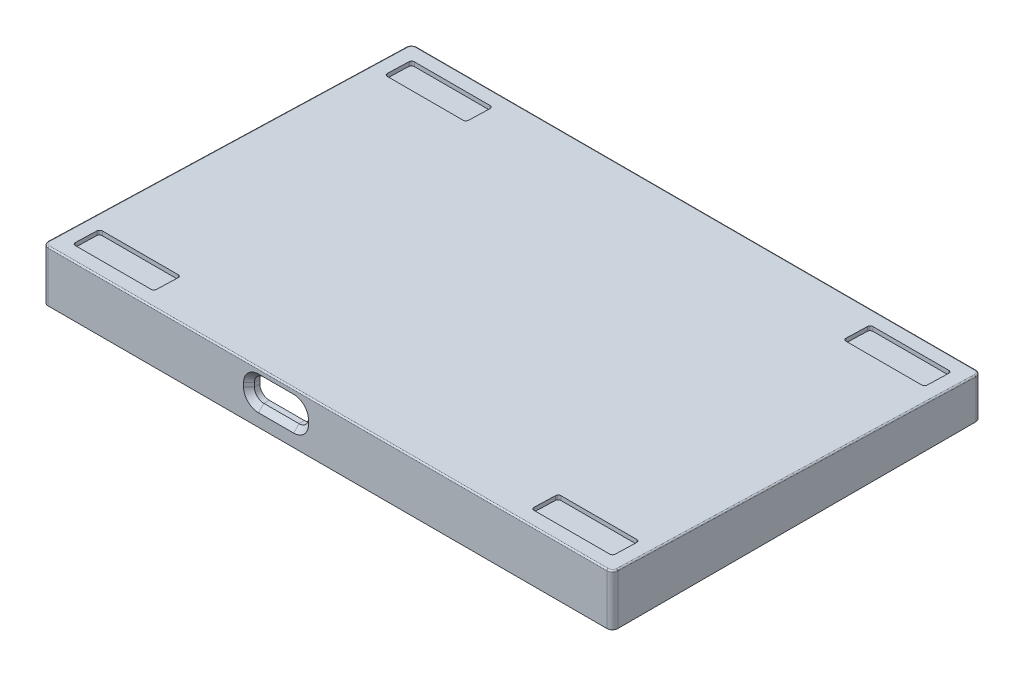
from build123d import *

# Parameters (mm, degrees)
SKETCH1_W           = 105.25
SKETCH1_H           = 68.15
SKETCH1_W_2         = 101.25
SKETCH1_H_2         = 64.15
BOSS_EXTRUDE1_DEPTH = 7.5
CUT_EXTRUDE1_DEPTH  = 125.009414965
BOSS_EXTRUDE5_DEPTH = 105.25
CUT_EXTRUDE2_REACH  = 125.247
CUT_EXTRUDE7_DEPTH  = 2
CHAMFER1_SIZE       = 1
SKETCH13_RX         = 5
SKETCH13_RY         = 4.997667954
BOSS_EXTRUDE7_DEPTH = 10
SKETCH14_W          = 64.15
SKETCH14_H          = 10
CUT_EXTRUDE3_DEPTH  = 45
SKETCH15_R          = 1.5
CUT_EXTRUDE4_DEPTH  = 3
SKETCH15_5_R        = 1.5
CUT_EXTRUDE5_DEPTH  = 4.5
FILLET1_R           = 1
FILLET2_R           = 0.25
CUT_EXTRUDE6_DEPTH  = 0.75


with BuildPart() as part:
    # Sketch1 → Boss-Extrude1 (new body)
    with BuildSketch(Plane(origin=(0, 0, 0), x_dir=(1, 0, 0), z_dir=(0, 1, 0))):
        with Locations((49.625, 31.075)):
            Rectangle(SKETCH1_W, SKETCH1_H)
        with Locations((49.625, 31.075)):
            Rectangle(SKETCH1_W_2, SKETCH1_H_2, mode=Mode.SUBTRACT)
    extrude(amount=BOSS_EXTRUDE1_DEPTH)

    # Sketch4 → Cut-Extrude1 (cut, through all)
    with BuildSketch(Plane.ZY.offset(3)):
        Polygon((-65.15, 7.5), (3, 7.5), (-65.15, 5.417829181), align=None)
    extrude(amount=-CUT_EXTRUDE1_DEPTH, mode=Mode.SUBTRACT)

    # Sketch7 → Boss-Extrude5 (add)
    with BuildSketch(Plane.ZY.offset(3)):
        Polygon((3, 7.5), (3, 9.5), (-65.15, 7.417829181), (-65.15, 5.417829181), align=None)
    extrude(amount=-BOSS_EXTRUDE5_DEPTH)

    # Sketch9 → Cut-Extrude2 (cut, up to next)
    with BuildSketch(Plane.XY.offset(3), mode=Mode.PRIVATE) as cut_extrude2_sk1:
        with BuildLine():
            Line((36.85, 7.04), (43.35, 7.04))
            ThreePointArc((43.35, 7.04), (44.233883476, 6.673883476), (44.6, 5.79))
            Line((44.6, 5.79), (44.6, 5.09))
            ThreePointArc((44.6, 5.09), (44.233883476, 4.206116524), (43.35, 3.84))
            Line((43.35, 3.84), (36.85, 3.84))
            ThreePointArc((36.85, 3.84), (35.966116524, 4.206116524), (35.6, 5.09))
            Line((35.6, 5.09), (35.6, 5.79))
            ThreePointArc((35.6, 5.79), (35.966116524, 6.673883476), (36.85, 7.04))
        make_face()
    cut_extrude2_tool1 = extrude(cut_extrude2_sk1.sketch, amount=-CUT_EXTRUDE2_REACH, mode=Mode.PRIVATE) & part.part
    add(cut_extrude2_tool1.solids().sort_by_distance((40.1, 5.44, 3))[0], mode=Mode.SUBTRACT)

    # Sketch17 → Cut-Extrude7 (cut)
    with BuildSketch(Plane.XY.offset(3)):
        with BuildLine():
            Line((35.1, 5.79), (35.1, 5.09))
            ThreePointArc((35.1, 5.09), (35.612563133, 3.852563133), (36.85, 3.34))
            Line((36.85, 3.34), (43.35, 3.34))
            ThreePointArc((43.35, 3.34), (44.587436867, 3.852563133), (45.1, 5.09))
            Line((45.1, 5.09), (45.1, 5.79))
            ThreePointArc((45.1, 5.79), (44.587436867, 7.027436867), (43.35, 7.54))
            Line((43.35, 7.54), (36.85, 7.54))
            ThreePointArc((36.85, 7.54), (35.612563133, 7.027436867), (35.1, 5.79))
        make_face()
    extrude(amount=-CUT_EXTRUDE7_DEPTH, mode=Mode.SUBTRACT)

    # Chamfer1
    chamfer1_edges = [part.edges().sort_by_distance(p)[0] for p in [
        (35.612563133, 7.027436867, 3),
        (35.1, 5.44, 3),
        (35.612563133, 3.852563133, 3),
        (40.1, 3.34, 3),
        (44.587436867, 3.852563133, 3),
        (45.1, 5.44, 3),
        (44.587436867, 7.027436867, 3),
        (40.1, 7.54, 3),
    ]]
    chamfer(chamfer1_edges, length=CHAMFER1_SIZE)

    # Sketch13 → Boss-Extrude7 (add)
    with BuildSketch(Plane(origin=(0, 7.401432685, -0.226134221), x_dir=(1, 0, 0), z_dir=(0, -0.9995335908367133, 0.03053851320981564))):
        with Locations(Location((89.25, -9.995335908), (0, 0, 180))):
            Ellipse(SKETCH13_RX, SKETCH13_RY)
        with Locations(Location((74.25, -37.1326729), (0, 0, 180))):
            Ellipse(SKETCH13_RX, SKETCH13_RY)
        with Locations(Location((25, -47.128008808), (0, 0, 180))):
            Ellipse(SKETCH13_RX, SKETCH13_RY)
        with Locations(Location((10, -24.988339771), (0, 0, 180))):
            Ellipse(SKETCH13_RX, SKETCH13_RY)
    extrude(amount=BOSS_EXTRUDE7_DEPTH)

    # Sketch14 → Cut-Extrude3 (cut, symmetric)
    with BuildSketch(Plane.ZY.offset(-49.625)):
        with Locations((-31.075, -1.31)):
            Rectangle(SKETCH14_W, SKETCH14_H)
    extrude(amount=CUT_EXTRUDE3_DEPTH, both=True, mode=Mode.SUBTRACT)

    # Sketch15 → Cut-Extrude4 (cut)
    with BuildSketch(Plane.XZ.offset(-3.69)):
        with Locations(Location((25, -47.262739697, 0), (0, 0, 270))):
            Circle(SKETCH15_R)
        with Locations(Location((74.25, -37.341488102, 0), (0, 0, 270))):
            Circle(SKETCH15_R)
    extrude(amount=-CUT_EXTRUDE4_DEPTH, mode=Mode.SUBTRACT)

    # Sketch15<5> → Cut-Extrude5 (cut)
    with BuildSketch(Plane.XZ.offset(-3.69)):
        with Locations(Location((10, -25.112739697, 0), (0, 0, 270))):
            Circle(SKETCH15_5_R)
        with Locations(Location((89.25, -10.112739697, 0), (0, 0, 270))):
            Circle(SKETCH15_5_R)
    extrude(amount=-CUT_EXTRUDE5_DEPTH, mode=Mode.SUBTRACT)

    # Fillet1
    fillet1_edges = [part.edges().sort_by_distance(p)[0] for p in [
        (-3, 3.708914591, -65.15),
        (102.25, 3.708914591, -65.15),
        (-3, 4.75, 3),
        (102.25, 4.75, 3),
    ]]
    fillet(fillet1_edges, radius=FILLET1_R)

    # Fillet2
    fillet2_edges = [part.edges().sort_by_distance(p)[0] for p in [
        (102.25, 8.458914591, -31.075),
        (49.625, 9.5, 3),
        (49.625, 7.417829181, -65.15),
        (-3, 8.458914591, -31.075),
        (-2.707189246, 9.491048783, 2.707024307),
        (-2.707189246, 7.426780398, -64.857024307),
        (101.957189246, 7.426780398, -64.857024307),
        (101.957189246, 9.491048783, 2.707024307),
    ]]
    fillet(fillet2_edges, radius=FILLET2_R)

    # Sketch16 → Cut-Extrude6 (cut)
    with BuildSketch(Plane(origin=(0, 9.399567483, -0.28718276), x_dir=(1, 0, 0), z_dir=(0, 0.9995335908367133, -0.03053851320981564))):
        with BuildLine():
            Line((99, 57.150605503), (85, 57.150605503))
            ThreePointArc((85, 57.150605503), (84.646446609, 57.297052112), (84.5, 57.650605503))
            Line((84.5, 57.650605503), (84.5, 61.650605503))
            ThreePointArc((84.5, 61.650605503), (84.646446609, 62.004158893), (85, 62.150605503))
            Line((85, 62.150605503), (99, 62.150605503))
            ThreePointArc((99, 62.150605503), (99.353553391, 62.004158893), (99.5, 61.650605503))
            Line((99.5, 61.650605503), (99.5, 57.650605503))
            ThreePointArc((99.5, 57.650605503), (99.353553391, 57.297052112), (99, 57.150605503))
        make_face()
        with BuildLine():
            Line((0.25, 62.150605503), (14.25, 62.150605503))
            ThreePointArc((14.25, 62.150605503), (14.603553391, 62.004158893), (14.75, 61.650605503))
            Line((14.75, 61.650605503), (14.75, 57.650605503))
            ThreePointArc((14.75, 57.650605503), (14.603553391, 57.297052112), (14.25, 57.150605503))
            Line((14.25, 57.150605503), (0.25, 57.150605503))
            ThreePointArc((0.25, 57.150605503), (-0.103553391, 57.297052112), (-0.25, 57.650605503))
            Line((-0.25, 57.650605503), (-0.25, 61.650605503))
            ThreePointArc((-0.25, 61.650605503), (-0.103553391, 62.004158893), (0.25, 62.150605503))
        make_face()
        with BuildLine():
            Line((99.5, -0.0309618), (99.5, 3.9690382))
            ThreePointArc((99.5, 3.9690382), (99.353553391, 4.32259159), (99, 4.4690382))
            Line((99, 4.4690382), (85, 4.4690382))
            ThreePointArc((85, 4.4690382), (84.646446609, 4.32259159), (84.5, 3.9690382))
            Line((84.5, 3.9690382), (84.5, -0.0309618))
            ThreePointArc((84.5, -0.0309618), (84.646446609, -0.384515191), (85, -0.5309618))
            Line((85, -0.5309618), (99, -0.5309618))
            ThreePointArc((99, -0.5309618), (99.353553391, -0.384515191), (99.5, -0.0309618))
        make_face()
        with BuildLine():
            Line((0.25, 4.4690382), (14.25, 4.4690382))
            ThreePointArc((14.25, 4.4690382), (14.603553391, 4.32259159), (14.75, 3.9690382))
            Line((14.75, 3.9690382), (14.75, -0.0309618))
            ThreePointArc((14.75, -0.0309618), (14.603553391, -0.384515191), (14.25, -0.5309618))
            Line((14.25, -0.5309618), (0.25, -0.5309618))
            ThreePointArc((0.25, -0.5309618), (-0.103553391, -0.384515191), (-0.25, -0.0309618))
            Line((-0.25, -0.0309618), (-0.25, 3.9690382))
            ThreePointArc((-0.25, 3.9690382), (-0.103553391, 4.32259159), (0.25, 4.4690382))
        make_face()
    extrude(amount=-CUT_EXTRUDE6_DEPTH, mode=Mode.SUBTRACT)


solid = part.part
